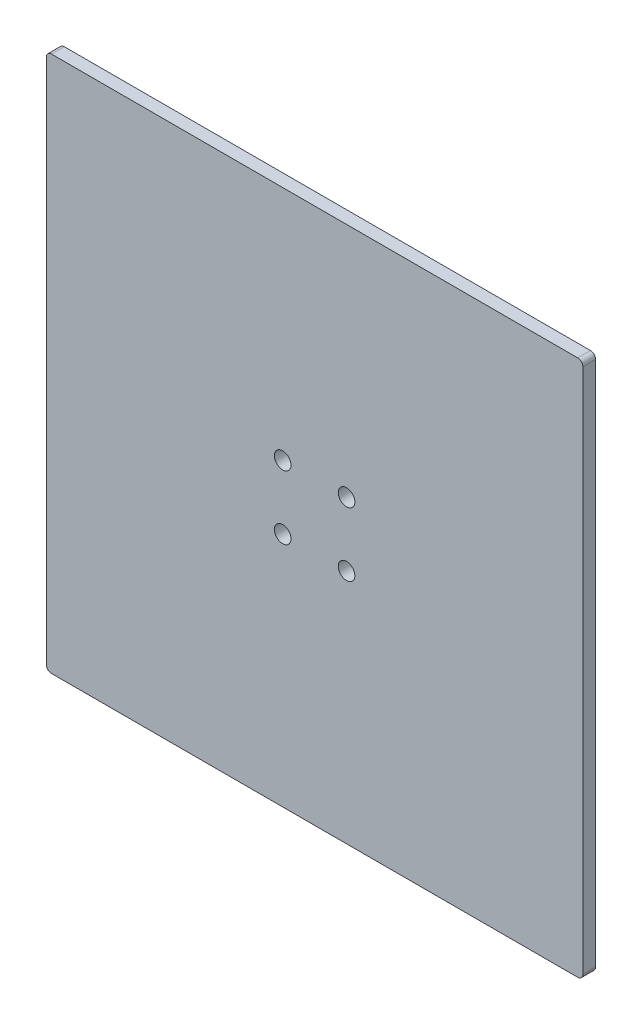
from build123d import *

# Parameters (mm, degrees)
CROQUIS1_W              = 210
CROQUIS1_H              = 210
CROQUIS1_R              = 3.25
SALIENTE_EXTRUIR1_DEPTH = 5
REDONDEO1_R             = 2


with BuildPart() as part:
    # Croquis1 → Saliente-Extruir1 (new body)
    with BuildSketch(Plane.XY):
        Rectangle(CROQUIS1_W, CROQUIS1_H)
        with Locations((-12.5, 12.5)):
            Circle(CROQUIS1_R, mode=Mode.SUBTRACT)
        with Locations((12.5, 12.5)):
            Circle(CROQUIS1_R, mode=Mode.SUBTRACT)
        with Locations((-12.5, -12.5)):
            Circle(CROQUIS1_R, mode=Mode.SUBTRACT)
        with Locations((12.5, -12.5)):
            Circle(CROQUIS1_R, mode=Mode.SUBTRACT)
    extrude(amount=SALIENTE_EXTRUIR1_DEPTH)

    # Redondeo1
    redondeo1_edges = [part.edges().sort_by_distance(p)[0] for p in [
        (-105, 105, 2.5),
        (105, 105, 2.5),
        (105, -105, 2.5),
        (-105, -105, 2.5),
    ]]
    fillet(redondeo1_edges, radius=REDONDEO1_R)


solid = part.part
